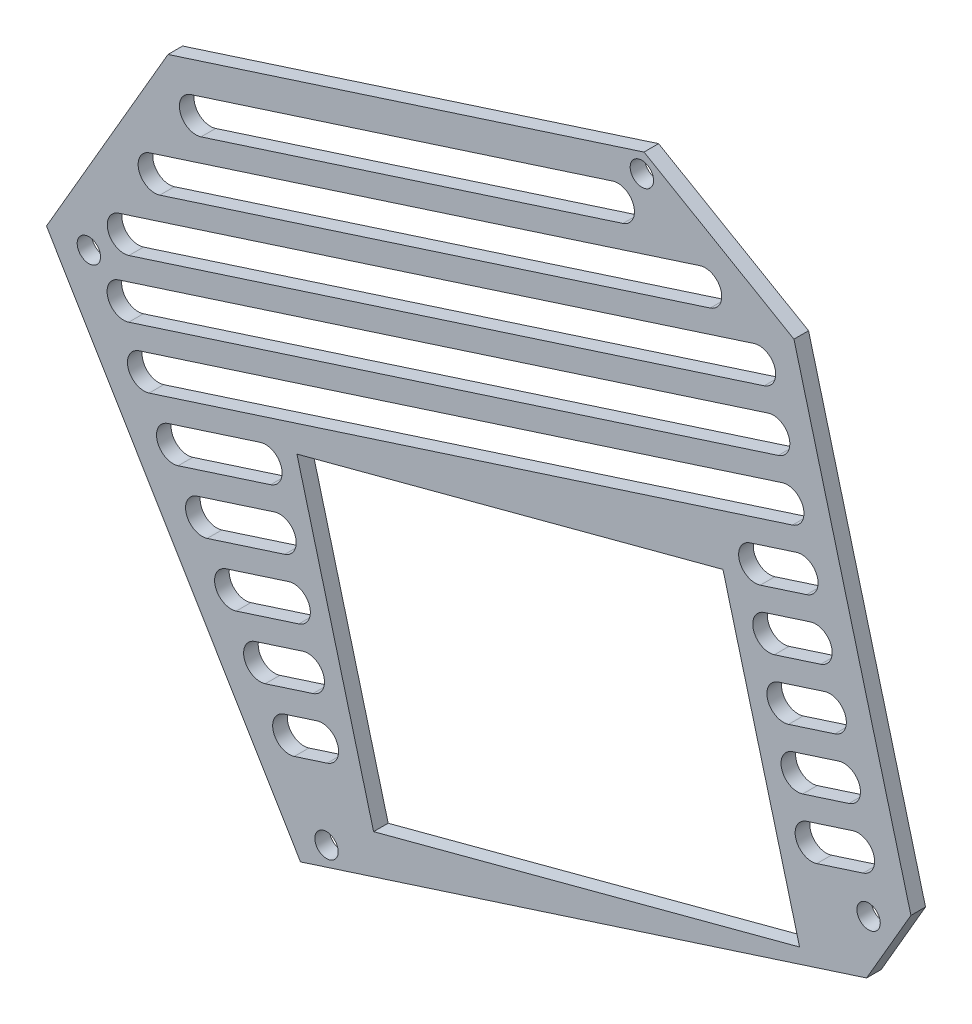
from build123d import *

# Parameters (mm, degrees)
SKETCH1_R           = 1.6
BOSS_EXTRUDE1_DEPTH = 2
CUT_EXTRUDE1_DEPTH  = 2
SKETCH3_R           = 1.6
CUT_EXTRUDE2_DEPTH  = 2


with BuildPart() as part:
    # Sketch1 → Boss-Extrude1 (new body)
    with BuildSketch(Plane.XY):
        Polygon((21.467142273, 12.757289388), (98.986558646, 37.747522695), (108.606128903, 54.320788113), (91.526252569, 118.656423166), (69.674428961, 131.339810968), (5.135356345, 110.534101153), (-15.668691868, 74.691438373), align=None)
        with Locations((25.032859693, 16.533479235)):
            Circle(SKETCH1_R, mode=Mode.SUBTRACT)
        with Locations((-7.513458012, 70.813355701)):
            Circle(SKETCH1_R, mode=Mode.SUBTRACT)
        with Locations((68.212815702, 117.73514623)):
            Circle(SKETCH1_R, mode=Mode.SUBTRACT)
        Polygon((31.474266896, 21.347469407), (89.813558069, 36.835431526), (79.318927702, 76.366087142), (20.979636529, 60.878125023), align=None, mode=Mode.SUBTRACT)
    extrude(amount=BOSS_EXTRUDE1_DEPTH)

    # Sketch2 → Cut-Extrude1 (cut)
    with BuildSketch(Plane.XY.offset(2)):
        Polygon((68.505138354, 120.456079177), (89.039456874, 108.537406864), (105.056492564, 48.205227479), (108.606128903, 54.320788113), (91.526252569, 118.656423166), (69.674428961, 131.339810968), (5.135356345, 110.534101153), (-15.668691868, 74.691438373), (-13.318631122, 70.77207004), (3.322736479, 99.442976827), align=None)
    extrude(amount=-CUT_EXTRUDE1_DEPTH, mode=Mode.SUBTRACT)

    # Sketch3 → Cut-Extrude2 (cut)
    with BuildSketch(Plane.XY.offset(2)):
        with Locations((99.259718064, 45.190330298)):
            Circle(SKETCH3_R)
        with BuildLine():
            Line((6.456725485, 96.250579726), (64.230526779, 114.875342927))
            ThreePointArc((64.230526779, 114.875342927), (67.087527478, 113.411325508), (65.623510059, 110.554324808))
            Line((65.623510059, 110.554324808), (7.849708766, 91.929561608))
            ThreePointArc((7.849708766, 91.929561608), (4.992708066, 93.393579027), (6.456725485, 96.250579726))
        make_face()
        with BuildLine():
            Line((0.807577645, 86.517834494), (76.18470113, 110.817448579))
            ThreePointArc((76.18470113, 110.817448579), (79.041701829, 109.35343116), (77.57768441, 106.496430461))
            Line((77.57768441, 106.496430461), (2.200560925, 82.196816376))
            ThreePointArc((2.200560925, 82.196816376), (-0.656439775, 83.660833795), (0.807577645, 86.517834494))
        make_face()
        with BuildLine():
            Line((-3.419178071, 77.243631299), (83.571572672, 105.287175206))
            ThreePointArc((83.571572672, 105.287175206), (86.428573372, 103.823157787), (84.964555952, 100.966157087))
            Line((84.964555952, 100.966157087), (-2.02619479, 72.92261318))
            ThreePointArc((-2.02619479, 72.92261318), (-4.88319549, 74.3866306), (-3.419178071, 77.243631299))
        make_face()
        with BuildLine():
            Line((-3.448967162, 69.322420425), (85.506365232, 97.999294098))
            ThreePointArc((85.506365232, 97.999294098), (88.363365932, 96.535276679), (86.899348513, 93.678275979))
            Line((86.899348513, 93.678275979), (-2.055983882, 65.001402307))
            ThreePointArc((-2.055983882, 65.001402307), (-4.912984581, 66.465419726), (-3.448967162, 69.322420425))
        make_face()
        with BuildLine():
            Line((-0.651479152, 62.312649778), (87.441157792, 90.71141299))
            ThreePointArc((87.441157792, 90.71141299), (90.298158492, 89.247395571), (88.834141073, 86.390394871))
            Line((88.834141073, 86.390394871), (0.741504129, 57.991631659))
            ThreePointArc((0.741504129, 57.991631659), (-2.115496571, 59.455649078), (-0.651479152, 62.312649778))
        make_face()
        with BuildLine():
            Line((83.038019838, 81.380348772), (89.375950353, 83.423531882))
            ThreePointArc((89.375950353, 83.423531882), (92.232951052, 81.959514463), (90.768933633, 79.102513764))
            Line((90.768933633, 79.102513764), (84.431003119, 77.059330653))
            ThreePointArc((84.431003119, 77.059330653), (81.574002419, 78.523348073), (83.038019838, 81.380348772))
        make_face()
        with BuildLine():
            Line((3.323909307, 55.682603442), (15.979695788, 59.762498153))
            ThreePointArc((15.979695788, 59.762498153), (18.836696487, 58.298480734), (17.372679068, 55.441480034))
            Line((17.372679068, 55.441480034), (4.716892588, 51.361585323))
            ThreePointArc((4.716892588, 51.361585323), (1.859891888, 52.825602742), (3.323909307, 55.682603442))
        make_face()
        with BuildLine():
            Line((7.299297766, 49.052557106), (17.914488348, 52.474617045))
            ThreePointArc((17.914488348, 52.474617045), (20.771489047, 51.010599626), (19.307471628, 48.153598926))
            Line((19.307471628, 48.153598926), (8.692281046, 44.731538987))
            ThreePointArc((8.692281046, 44.731538987), (5.835280347, 46.195556407), (7.299297766, 49.052557106))
        make_face()
        with BuildLine():
            Line((11.274686225, 42.42251077), (19.849280908, 45.186735937))
            ThreePointArc((19.849280908, 45.186735937), (22.706281607, 43.722718518), (21.242264188, 40.865717818))
            Line((21.242264188, 40.865717818), (12.667669505, 38.101492652))
            ThreePointArc((12.667669505, 38.101492652), (9.810668805, 39.565510071), (11.274686225, 42.42251077))
        make_face()
        with BuildLine():
            Line((15.250074683, 35.792464434), (21.784073468, 37.898854829))
            ThreePointArc((21.784073468, 37.898854829), (24.641074168, 36.43483741), (23.177056748, 33.577836711))
            Line((23.177056748, 33.577836711), (16.643057964, 31.471446316))
            ThreePointArc((16.643057964, 31.471446316), (13.786057264, 32.935463735), (15.250074683, 35.792464434))
        make_face()
        with BuildLine():
            Line((19.225463142, 29.162418098), (23.718866028, 30.610973721))
            ThreePointArc((23.718866028, 30.610973721), (26.575866728, 29.146956302), (25.111849309, 26.289955603))
            Line((25.111849309, 26.289955603), (20.618446422, 24.84139998))
            ThreePointArc((20.618446422, 24.84139998), (17.761445723, 26.305417399), (19.225463142, 29.162418098))
        make_face()
        with BuildLine():
            Line((84.972812398, 74.092467664), (91.310742913, 76.135650774))
            ThreePointArc((91.310742913, 76.135650774), (94.167743612, 74.671633355), (92.703726193, 71.814632656))
            Line((92.703726193, 71.814632656), (86.365795679, 69.771449546))
            ThreePointArc((86.365795679, 69.771449546), (83.508794979, 71.235466965), (84.972812398, 74.092467664))
        make_face()
        with BuildLine():
            Line((86.907604959, 66.804586556), (93.245535473, 68.847769666))
            ThreePointArc((93.245535473, 68.847769666), (96.102536172, 67.383752247), (94.638518753, 64.526751548))
            Line((94.638518753, 64.526751548), (88.300588239, 62.483568438))
            ThreePointArc((88.300588239, 62.483568438), (85.44358754, 63.947585857), (86.907604959, 66.804586556))
        make_face()
        with BuildLine():
            Line((88.842397519, 59.516705448), (95.180328033, 61.559888559))
            ThreePointArc((95.180328033, 61.559888559), (98.037328733, 60.095871139), (96.573311314, 57.23887044))
            Line((96.573311314, 57.23887044), (90.235380799, 55.19568733))
            ThreePointArc((90.235380799, 55.19568733), (87.3783801, 56.659704749), (88.842397519, 59.516705448))
        make_face()
        with BuildLine():
            Line((90.777190079, 52.228824341), (97.115120593, 54.272007451))
            ThreePointArc((97.115120593, 54.272007451), (99.972121293, 52.807990032), (98.508103874, 49.950989332))
            Line((98.508103874, 49.950989332), (92.170173359, 47.907806222))
            ThreePointArc((92.170173359, 47.907806222), (89.31317266, 49.371823641), (90.777190079, 52.228824341))
        make_face()
    extrude(amount=-CUT_EXTRUDE2_DEPTH, mode=Mode.SUBTRACT)


solid = part.part
